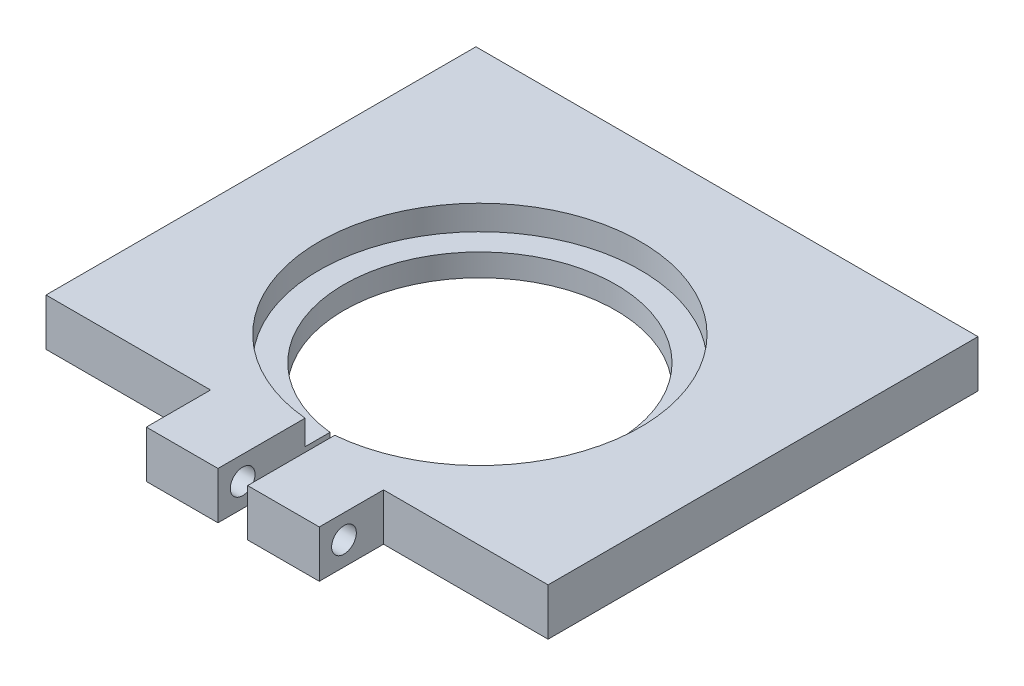
from build123d import *

# Parameters (mm, degrees)
ESBO_O1_W                = 101.6
ESBO_O1_H                = 100
RESSALTO_EXTRUS_O1_DEPTH = 9.53
ESBO_O2_R                = 2.6
CORTE_EXTRUS_O1_DEPTH    = 20
ESBO_O3_R                = 32.51
CORTE_EXTRUS_O2_DEPTH    = 5
CORTE_EXTRUS_O3_REACH    = 73.454
ESBO_O4_R                = 27.5
CORTE_EXTRUS_O4_REACH    = 73.913
ESBO_O5_W                = 33.3
ESBO_O5_H                = 13
CORTE_EXTRUS_O5_REACH    = 73.913
ESBO_O6_W                = 6
ESBO_O6_H                = 29.667415493
CORTE_EXTRUS_O6_REACH    = 87.18
ESBO_O7_R                = 2.5


with BuildPart() as part:
    # Esboço1 → Ressalto-extrusão1 (new body)
    with BuildSketch(Plane(origin=(0, 0, 0), x_dir=(1, 0, 0), z_dir=(0, 1, 0))):
        Rectangle(ESBO_O1_W, ESBO_O1_H)
    extrude(amount=RESSALTO_EXTRUS_O1_DEPTH)

    # Esboço2 → Corte-extrusão1 (cut)
    with BuildSketch(Plane(origin=(0, 0, -50), x_dir=(-1, 0, 0), z_dir=(0, 0, -1))):
        with Locations((-45.8, 4.76)):
            Circle(ESBO_O2_R)
        with Locations((-22.8, 4.76)):
            Circle(ESBO_O2_R)
        with Locations((22.8, 4.76)):
            Circle(ESBO_O2_R)
        with Locations((45.8, 4.76)):
            Circle(ESBO_O2_R)
    extrude(amount=-CORTE_EXTRUS_O1_DEPTH, mode=Mode.SUBTRACT)

    # Esboço3 → Corte-extrusão2 (cut)
    with BuildSketch(Plane(origin=(0, 9.53, 0), x_dir=(1, 0, 0), z_dir=(0, 1, 0))):
        with Locations(Location((0, 0, 0), (0, 0, 270))):
            Circle(ESBO_O3_R)
    extrude(amount=-CORTE_EXTRUS_O2_DEPTH, mode=Mode.SUBTRACT)

    # Esboço4 → Corte-extrusão3 (cut, up to next)
    with BuildSketch(Plane(origin=(0, 4.53, 0), x_dir=(1, 0, 0), z_dir=(0, 1, 0)), mode=Mode.PRIVATE) as corte_extrus_o3_sk1:
        with Locations(Location((0, 0, 0), (0, 0, 270))):
            Circle(ESBO_O4_R)
    corte_extrus_o3_tool1 = extrude(corte_extrus_o3_sk1.sketch, amount=-CORTE_EXTRUS_O3_REACH, mode=Mode.PRIVATE) & part.part
    add(corte_extrus_o3_tool1.solids().sort_by_distance((0, 4.53, 0))[0], mode=Mode.SUBTRACT)

    # Esboço5 → Corte-extrusão4 (cut, up to next)
    with BuildSketch(Plane(origin=(0, 9.53, 0), x_dir=(1, 0, 0), z_dir=(0, 1, 0)), mode=Mode.PRIVATE) as corte_extrus_o4_sk1:
        with Locations((34.15, -43.5)):
            Rectangle(ESBO_O5_W, ESBO_O5_H)
    corte_extrus_o4_tool1 = extrude(corte_extrus_o4_sk1.sketch, amount=-CORTE_EXTRUS_O4_REACH, mode=Mode.PRIVATE) & part.part
    # Esboço5 → Corte-extrusão4 (cut, up to next)
    with BuildSketch(Plane(origin=(0, 9.53, 0), x_dir=(1, 0, 0), z_dir=(0, 1, 0)), mode=Mode.PRIVATE) as corte_extrus_o4_sk2:
        with Locations((-34.15, -43.5)):
            Rectangle(ESBO_O5_W, ESBO_O5_H)
    corte_extrus_o4_tool2 = extrude(corte_extrus_o4_sk2.sketch, amount=-CORTE_EXTRUS_O4_REACH, mode=Mode.PRIVATE) & part.part
    add(corte_extrus_o4_tool1.solids().sort_by_distance((34.15, 9.53, 43.5))[0], mode=Mode.SUBTRACT)
    add(corte_extrus_o4_tool2.solids().sort_by_distance((-34.15, 9.53, 43.5))[0], mode=Mode.SUBTRACT)

    # Esboço6 → Corte-extrusão5 (cut, up to next)
    with BuildSketch(Plane(origin=(0, 9.53, 0), x_dir=(1, 0, 0), z_dir=(0, 1, 0)), mode=Mode.PRIVATE) as corte_extrus_o5_sk1:
        with Locations((0, -35.166292254)):
            Rectangle(ESBO_O6_W, ESBO_O6_H)
    corte_extrus_o5_tool1 = extrude(corte_extrus_o5_sk1.sketch, amount=-CORTE_EXTRUS_O5_REACH, mode=Mode.PRIVATE) & part.part
    add(corte_extrus_o5_tool1.solids().sort_by_distance((0, 9.53, 35.166292))[0], mode=Mode.SUBTRACT)

    # Corte-extrusão6: up to this face of the body (flat: up to its plane)
    corte_extrus_o6_end = Plane(part.part.faces().sort_by_distance((17.5, 4.765, 43.5))[0])
    # Esboço7 → Corte-extrusão6 (cut, up to the picked face)
    with BuildSketch(Plane.ZY.offset(17.5), mode=Mode.PRIVATE) as corte_extrus_o6_sk1:
        with Locations((45, 4.765)):
            Circle(ESBO_O7_R)
    corte_extrus_o6_tool1 = split(extrude(corte_extrus_o6_sk1.sketch, amount=-CORTE_EXTRUS_O6_REACH, mode=Mode.PRIVATE), bisect_by=corte_extrus_o6_end, keep=Keep.BOTH, mode=Mode.PRIVATE)
    add(corte_extrus_o6_tool1.solids().sort_by(Axis((-17.5, 4.765, 45), (1, 0, 0)))[0], mode=Mode.SUBTRACT)


solid = part.part
